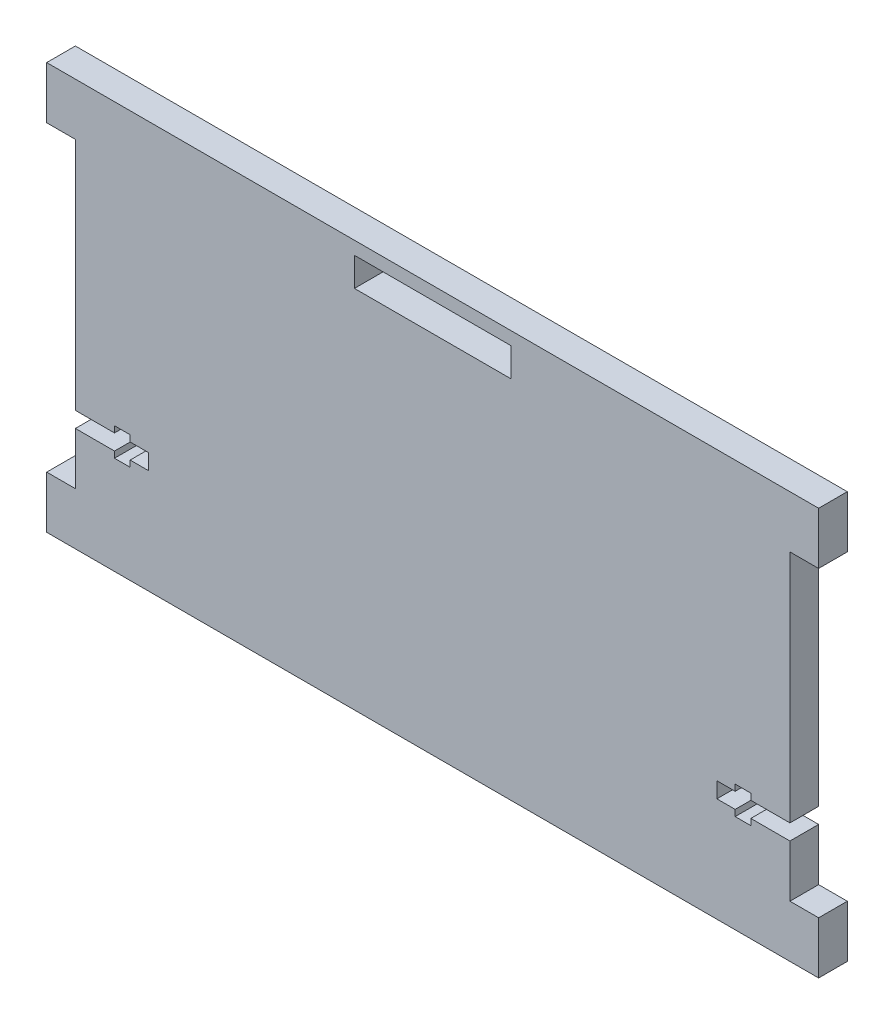
from build123d import *

# Parameters (mm, degrees)
SKETCH1_W           = 30
SKETCH1_H           = 5.5
BOSS_EXTRUDE1_DEPTH = 5.5


with BuildPart() as part:
    # Sketch1 → Boss-Extrude1 (new body)
    with BuildSketch(Plane.XY):
        Polygon((0, 23), (0, 68), (-5.5, 68), (-5.5, 78), (0, 78), (137, 78), (142.5, 78), (142.5, 68), (137, 68), (137, 23), (129.5, 23), (129.5, 24.2), (126.5, 24.2), (126.5, 23), (123, 23), (123, 20), (126.5, 20), (126.5, 18.8), (129.5, 18.8), (129.5, 20), (137, 20), (137, 10), (142.5, 10), (142.5, 0), (137, 0), (0, 0), (-5.5, 0), (-5.5, 10), (0, 10), (0, 20), (7.5, 20), (7.5, 18.8), (10.5, 18.8), (10.5, 20), (14, 20), (14, 23), (10.5, 23), (10.5, 24.2), (7.5, 24.2), (7.5, 23), align=None)
        with Locations((68.5, 72.75)):
            Rectangle(SKETCH1_W, SKETCH1_H, mode=Mode.SUBTRACT)
    extrude(amount=BOSS_EXTRUDE1_DEPTH)


solid = part.part
